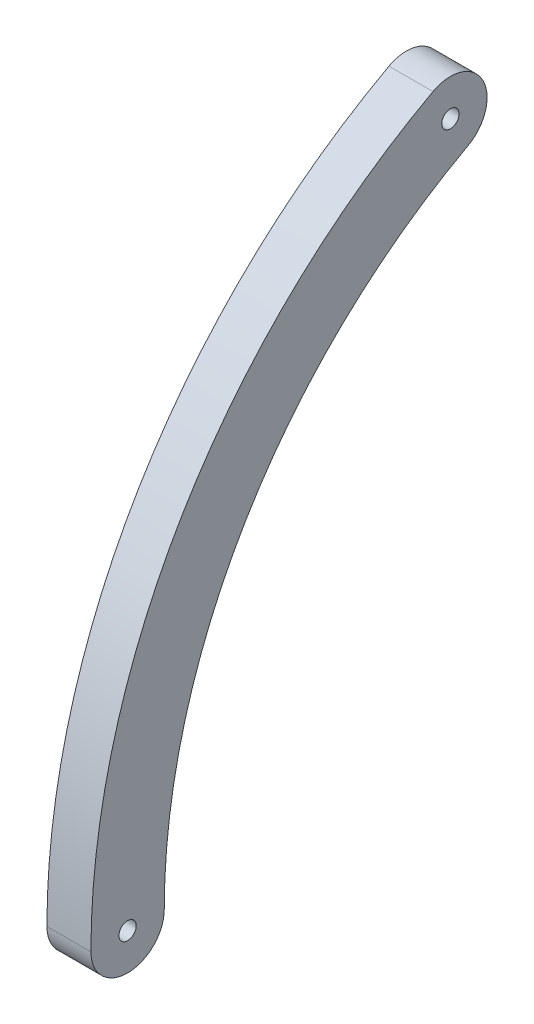
from build123d import *

# Parameters (mm, degrees)
ESQUISSE1_R        = 0.75
BOSS_EXTRU_1_DEPTH = 3.81


with BuildPart() as part:
    # Esquisse1 → Boss.-Extru.1 (new body)
    with BuildSketch(Plane(origin=(0, 0, 0), x_dir=(0, 0, -1), z_dir=(1, 0, 0))):
        with BuildLine():
            ThreePointArc((-50.165, 0), (-43.093852353, 25.679702381), (-23.873876134, 44.119896457))
            ThreePointArc((-23.873876134, 44.119896457), (-22.592482442, 48.423299785), (-26.895885771, 49.704693477))
            ThreePointArc((-26.895885771, 49.704693477), (-48.548770372, 28.930297619), (-56.515, 0))
            ThreePointArc((-56.515, 0), (-53.34, -3.175), (-50.165, 0))
        make_face()
        with Locations(Location((-53.34, 0, 0), (0, 0, 180))):
            Circle(ESQUISSE1_R, mode=Mode.SUBTRACT)
        with Locations(Location((-25.384880952, 46.912294967, 0), (0, 0, 180))):
            Circle(ESQUISSE1_R, mode=Mode.SUBTRACT)
    extrude(amount=BOSS_EXTRU_1_DEPTH)


solid = part.part
